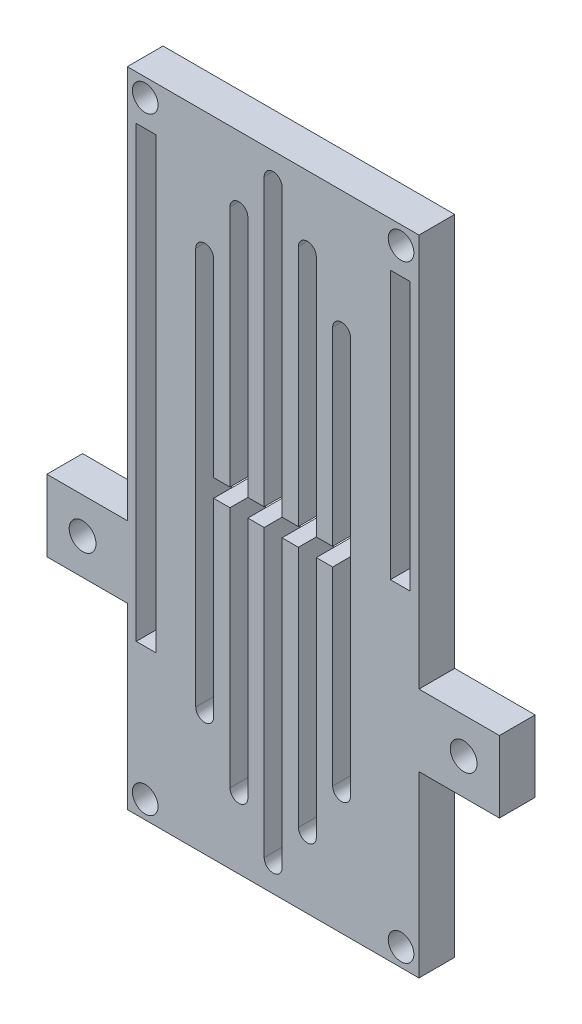
from build123d import *

# Parameters (mm, degrees)
CROQUIS1_W              = 32.64
CROQUIS1_H              = 72
CROQUIS1_R              = 1.435
SALIENTE_EXTRUIR4_DEPTH = 4
CROQUIS3_W              = 9
CROQUIS3_H              = 8
CROQUIS3_R              = 1.5
SALIENTE_EXTRUIR5_DEPTH = 4
CROQUIS6_W              = 5.968272271
CROQUIS6_H              = 30
SALIENTE_EXTRUIR6_DEPTH = 4
CROQUIS5_W              = 2.2
CROQUIS5_H              = 50.2
CROQUIS5_H_2            = 30
CORTAR_EXTRUIR1_DEPTH   = 4


with BuildPart() as part:
    # Croquis1 → Saliente-Extruir4 (new body)
    with BuildSketch(Plane.XY):
        with Locations((16.32, 36)):
            Rectangle(CROQUIS1_W, CROQUIS1_H)
        with Locations((2.005, 69.99)):
            Circle(CROQUIS1_R, mode=Mode.SUBTRACT)
        with Locations((2.005, 2.01)):
            Circle(CROQUIS1_R, mode=Mode.SUBTRACT)
        with Locations(Location((30.635, 2.01, 0), (0, 0, 180))):
            Circle(CROQUIS1_R, mode=Mode.SUBTRACT)
        with Locations(Location((30.635, 69.99, 0), (0, 0, 180))):
            Circle(CROQUIS1_R, mode=Mode.SUBTRACT)
        with BuildLine():
            Line((15.32, 3.01), (15.32, 35))
            Line((15.32, 35), (13.49, 35))
            Line((13.49, 35), (13.49, 34))
            Line((13.49, 34), (13.49, 7.851322515))
            ThreePointArc((13.49, 7.851322515), (12.49, 6.851322515), (11.49, 7.851322515))
            Line((11.49, 7.851322515), (11.49, 34))
            Line((11.49, 34), (11.49, 35))
            Line((11.49, 35), (9.66, 35))
            Line((9.66, 35), (9.66, 34))
            Line((9.66, 34), (9.66, 13.772536222))
            ThreePointArc((9.66, 13.772536222), (8.66, 12.772536222), (7.66, 13.772536222))
            Line((7.66, 13.772536222), (7.66, 34))
            Line((7.66, 34), (7.66, 35))
            Line((7.66, 35), (5.83, 35))
            Line((5.83, 35), (5.83, 34))
            Line((5.83, 34), (5.83, 23.099052443))
            ThreePointArc((5.83, 23.099052443), (4.83, 22.099052443), (3.83, 23.099052443))
            Line((3.83, 23.099052443), (3.83, 34))
            Line((3.83, 34), (3.83, 35))
            Line((3.83, 35), (3.005, 35))
            ThreePointArc((3.005, 35), (2.005, 36), (3.005, 37))
            Line((3.005, 37), (3.83, 37))
            Line((3.83, 37), (3.83, 38))
            Line((3.83, 38), (3.83, 48.900947557))
            ThreePointArc((3.83, 48.900947557), (4.83, 49.900947557), (5.83, 48.900947557))
            Line((5.83, 48.900947557), (5.83, 38))
            Line((5.83, 38), (5.83, 37))
            Line((5.83, 37), (7.66, 37))
            Line((7.66, 37), (7.66, 38))
            Line((7.66, 38), (7.66, 58.227463778))
            ThreePointArc((7.66, 58.227463778), (8.66, 59.227463778), (9.66, 58.227463778))
            Line((9.66, 58.227463778), (9.66, 38))
            Line((9.66, 38), (9.66, 37))
            Line((9.66, 37), (11.49, 37))
            Line((11.49, 37), (11.49, 38))
            Line((11.49, 38), (11.49, 64.148677485))
            ThreePointArc((11.49, 64.148677485), (12.49, 65.148677485), (13.49, 64.148677485))
            Line((13.49, 64.148677485), (13.49, 38))
            Line((13.49, 38), (13.49, 37))
            Line((13.49, 37), (15.32, 37))
            Line((15.32, 37), (15.32, 68.99))
            ThreePointArc((15.32, 68.99), (16.32, 69.99), (17.32, 68.99))
            Line((17.32, 68.99), (17.32, 37))
            Line((17.32, 37), (19.15, 37))
            Line((19.15, 37), (19.15, 38))
            Line((19.15, 38), (19.15, 64.148677485))
            ThreePointArc((19.15, 64.148677485), (20.15, 65.148677485), (21.15, 64.148677485))
            Line((21.15, 64.148677485), (21.15, 38))
            Line((21.15, 38), (21.15, 37))
            Line((21.15, 37), (22.98, 37))
            Line((22.98, 37), (22.98, 38))
            Line((22.98, 38), (22.98, 58.227463778))
            ThreePointArc((22.98, 58.227463778), (23.98, 59.227463778), (24.98, 58.227463778))
            Line((24.98, 58.227463778), (24.98, 38))
            Line((24.98, 38), (24.98, 37))
            Line((24.98, 37), (26.81, 37))
            Line((26.81, 37), (26.81, 38))
            Line((26.81, 38), (26.81, 48.900947557))
            ThreePointArc((26.81, 48.900947557), (27.81, 49.900947557), (28.81, 48.900947557))
            Line((28.81, 48.900947557), (28.81, 38))
            Line((28.81, 38), (28.81, 37))
            Line((28.81, 37), (29.635, 37))
            ThreePointArc((29.635, 37), (30.635, 36), (29.635, 35))
            Line((29.635, 35), (28.81, 35))
            Line((28.81, 35), (28.81, 34))
            Line((28.81, 34), (28.81, 23.099052443))
            ThreePointArc((28.81, 23.099052443), (27.81, 22.099052443), (26.81, 23.099052443))
            Line((26.81, 23.099052443), (26.81, 34))
            Line((26.81, 34), (26.81, 35))
            Line((26.81, 35), (24.98, 35))
            Line((24.98, 35), (24.98, 34))
            Line((24.98, 34), (24.98, 13.772536222))
            ThreePointArc((24.98, 13.772536222), (23.98, 12.772536222), (22.98, 13.772536222))
            Line((22.98, 13.772536222), (22.98, 34))
            Line((22.98, 34), (22.98, 35))
            Line((22.98, 35), (21.15, 35))
            Line((21.15, 35), (21.15, 34))
            Line((21.15, 34), (21.15, 7.851322515))
            ThreePointArc((21.15, 7.851322515), (20.15, 6.851322515), (19.15, 7.851322515))
            Line((19.15, 7.851322515), (19.15, 34))
            Line((19.15, 34), (19.15, 35))
            Line((19.15, 35), (17.32, 35))
            Line((17.32, 35), (17.32, 3.01))
            ThreePointArc((17.32, 3.01), (16.32, 2.01), (15.32, 3.01))
        make_face(mode=Mode.SUBTRACT)
    extrude(amount=SALIENTE_EXTRUIR4_DEPTH)

    # Croquis3 → Saliente-Extruir5 (add)
    # profile 1 of 2: a face of its own
    with BuildSketch(Plane.XY.offset(4)):
        with Locations((-4.5, 24)):
            Rectangle(CROQUIS3_W, CROQUIS3_H)
        with Locations((-5, 24)):
            Circle(CROQUIS3_R, mode=Mode.SUBTRACT)
    # profile 2 of 2: a face of its own
    with BuildSketch(Plane.XY.offset(4)):
        with Locations((37.14, 24)):
            Rectangle(CROQUIS3_W, CROQUIS3_H)
        with Locations((37.64, 24)):
            Circle(CROQUIS3_R, mode=Mode.SUBTRACT)
    extrude(amount=-SALIENTE_EXTRUIR5_DEPTH)

    # Croquis6 → Saliente-Extruir6 (add)
    with BuildSketch(Plane.XY.offset(4)):
        with Locations((4.675863865, 36)):
            Rectangle(CROQUIS6_W, CROQUIS6_H)
        with Locations((27.964136135, 36)):
            Rectangle(CROQUIS6_W, CROQUIS6_H)
    extrude(amount=-SALIENTE_EXTRUIR6_DEPTH)

    # Croquis5 → Cortar-Extruir1 (cut)
    with BuildSketch(Plane.XY.offset(4)):
        with Locations((2.1, 41.9)):
            Rectangle(CROQUIS5_W, CROQUIS5_H)
        with Locations((30.54, 52)):
            Rectangle(CROQUIS5_W, CROQUIS5_H_2)
    extrude(amount=-CORTAR_EXTRUIR1_DEPTH, mode=Mode.SUBTRACT)


solid = part.part
